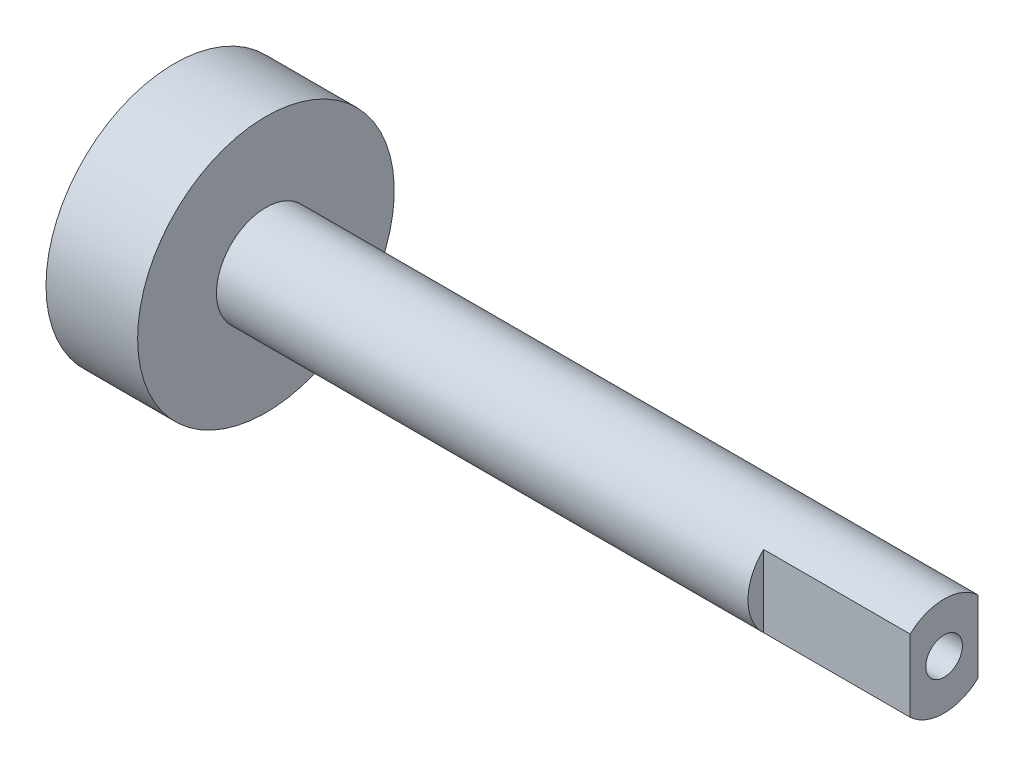
from build123d import *

# Parameters (mm, degrees)
SKETCH1_R           = 2.7
BOSS_EXTRUDE1_DEPTH = 18.5
CUT_EXTRUDE1_DEPTH  = 8
SKETCH3_R           = 1
CUT_EXTRUDE2_DEPTH  = 6
SKETCH5_R           = 7
BOSS_EXTRUDE2_DEPTH = 5


with BuildPart() as part:
    # Sketch1 → Boss-Extrude1 (new, symmetric)
    with BuildSketch(Plane(origin=(0, 0, 0), x_dir=(0, 0, -1), z_dir=(1, 0, 0))):
        Circle(SKETCH1_R)
    extrude(amount=BOSS_EXTRUDE1_DEPTH, both=True)

    # Sketch2 → Cut-Extrude1 (cut)
    with BuildSketch(Plane(origin=(18.5, 0, 0), x_dir=(0, 0, -1), z_dir=(1, 0, 0))):
        with BuildLine():
            Line((-1.85, 1.966596044), (-1.85, -1.966596044))
            ThreePointArc((-1.85, -1.966596044), (-2.7, 0), (-1.85, 1.966596044))
        make_face()
        with BuildLine():
            Line((1.85, 1.966596044), (1.85, -1.966596044))
            ThreePointArc((1.85, -1.966596044), (2.7, 0), (1.85, 1.966596044))
        make_face()
    extrude(amount=-CUT_EXTRUDE1_DEPTH, mode=Mode.SUBTRACT)

    # Sketch3 → Cut-Extrude2 (cut)
    with BuildSketch(Plane(origin=(18.5, 0, 0), x_dir=(0, 0, -1), z_dir=(1, 0, 0))):
        Circle(SKETCH3_R)
    extrude(amount=-CUT_EXTRUDE2_DEPTH, mode=Mode.SUBTRACT)

    # Sketch5 → Boss-Extrude2 (add)
    with BuildSketch(Plane.ZY.offset(18.5)):
        Circle(SKETCH5_R)
    extrude(amount=BOSS_EXTRUDE2_DEPTH)


solid = part.part
